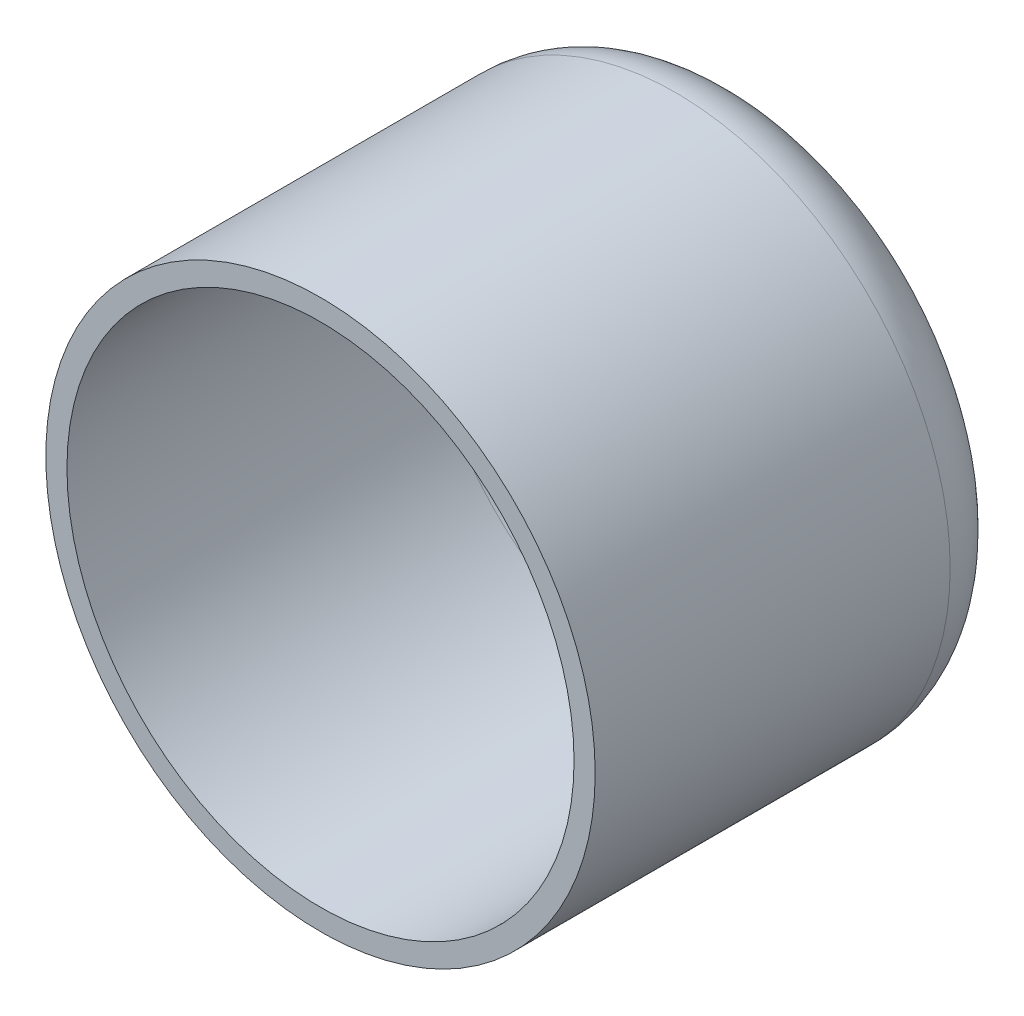
from build123d import *

# Parameters (mm, degrees)
SKETCH2_R           = 10.31875
BOSS_EXTRUDE1_DEPTH = 15.875
FILLET1_R           = 2.54
SHELL1_T            = -0.79375


with BuildPart() as part:
    # Sketch2 → Boss-Extrude1 (new body)
    with BuildSketch(Plane.XY):
        Circle(SKETCH2_R)
    extrude(amount=BOSS_EXTRUDE1_DEPTH)

    # Fillet1
    fillet1_edges = [part.edges().sort_by_distance(p)[0] for p in [
        (-10.31875, 0, 0),
    ]]
    fillet(fillet1_edges, radius=FILLET1_R)

    # Shell1
    shell1_openings = [part.faces().sort_by_distance(p)[0] for p in [
        (0, 0, 15.875),
    ]]
    offset(amount=SHELL1_T, openings=shell1_openings, kind=Kind.INTERSECTION)


solid = part.part
